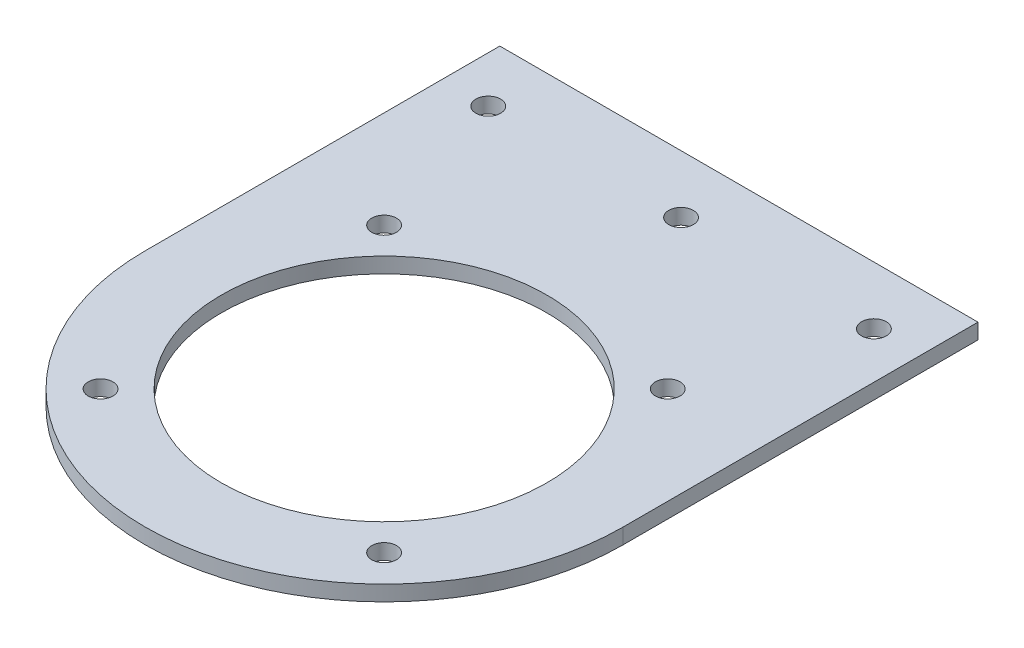
from build123d import *

# Parameters (mm, degrees)
SKETCH_1_R      = 1.6
SKETCH_1_R_2    = 31
SKETCH_1_R_3    = 21.1
EXTRUDE_1_DEPTH = 2


with BuildPart() as part:
    # 草图1 → 凸台-拉伸1 (new body)
    # profile 1 of 2: a face of its own
    with BuildSketch(Plane(origin=(0, 0, 0), x_dir=(1, 0, 0), z_dir=(0, 1, 0))):
        with BuildLine():
            Line((-31, 31), (-31, 0))
            ThreePointArc((-31, 0), (0, 31), (31, 0))
            Line((31, 0), (31, 31))
            Line((31, 31), (31, 46))
            Line((31, 46), (-31, 46))
            Line((-31, 46), (-31, 31))
        make_face()
        with Locations(Location((-25, 38.5, 0), (0, 0, 270))):
            Circle(SKETCH_1_R, mode=Mode.SUBTRACT)
        with Locations(Location((0, 38.5, 0), (0, 0, 270))):
            Circle(SKETCH_1_R, mode=Mode.SUBTRACT)
        with Locations(Location((25, 38.5, 0), (0, 0, 270))):
            Circle(SKETCH_1_R, mode=Mode.SUBTRACT)
    # profile 2 of 2: a face of its own
    with BuildSketch(Plane(origin=(0, 0, 0), x_dir=(1, 0, 0), z_dir=(0, 1, 0))):
        Circle(SKETCH_1_R_2)
        with Locations(Location((-18.384776311, 18.384776311, 0), (0, 0, 270))):
            Circle(SKETCH_1_R, mode=Mode.SUBTRACT)
        with Locations(Location((-18.384776311, -18.384776311, 0), (0, 0, 270))):
            Circle(SKETCH_1_R, mode=Mode.SUBTRACT)
        with Locations(Location((18.384776311, -18.384776311, 0), (0, 0, 270))):
            Circle(SKETCH_1_R, mode=Mode.SUBTRACT)
        with Locations(Location((18.384776311, 18.384776311, 0), (0, 0, 270))):
            Circle(SKETCH_1_R, mode=Mode.SUBTRACT)
        with Locations(Location((0, 0, 0), (0, 0, 270))):
            Circle(SKETCH_1_R_3, mode=Mode.SUBTRACT)
    extrude(amount=EXTRUDE_1_DEPTH)


solid = part.part
